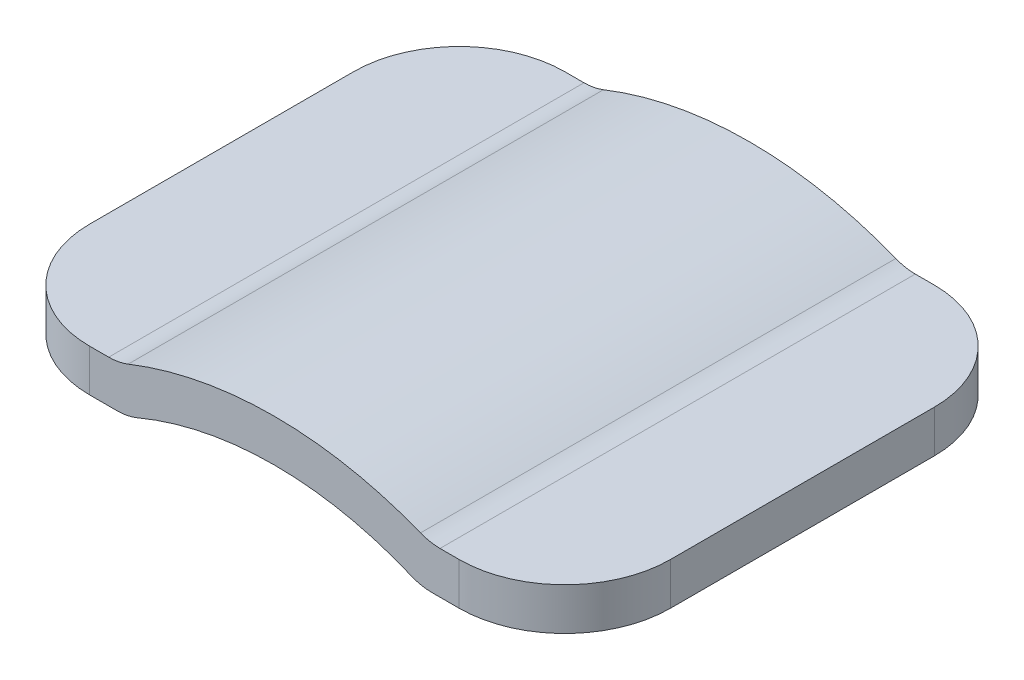
from build123d import *

# Parameters (mm, degrees)
EXTRUDE_1_DEPTH     = 900
SKETCH_3_OUTSIDE_W  = 2773.258
SKETCH_3_OUTSIDE_H  = 2373.258
CUT_EXTRUDE_3_DEPTH = 1431.244734302


with BuildPart() as part:
    # Эскиз1 → Бобышка-Вытянуть1 (new, symmetric)
    with BuildSketch(Plane.XY):
        with BuildLine():
            Line((-1100, -120), (-1100, 40))
            Line((-1100, 40), (-627.375485654, 40))
            ThreePointArc((-627.375485654, 40), (-589.802028189, 43.561115626), (-553.566604989, 54.117647059))
            ThreePointArc((-553.566604989, 54.117647059), (0, 160), (553.566604989, 54.117647059))
            ThreePointArc((553.566604989, 54.117647059), (589.802028189, 43.561115626), (627.375485654, 40))
            Line((627.375485654, 40), (1100, 40))
            Line((1100, 40), (1100, -120))
            Line((1100, -120), (595.98657703, -120))
            ThreePointArc((595.98657703, -120), (556.509475332, -116.065189265), (518.58572287, -104.415584416))
            ThreePointArc((518.58572287, -104.415584416), (0, 0), (-518.58572287, -104.415584416))
            ThreePointArc((-518.58572287, -104.415584416), (-556.509475332, -116.065189265), (-595.98657703, -120))
            Line((-595.98657703, -120), (-1100, -120))
        make_face()
    extrude(amount=EXTRUDE_1_DEPTH, both=True)

    # Эскиз3 outside → Вырез-Вытянуть3 (cut, through all)
    with BuildSketch(Plane(origin=(0, 40, 0), x_dir=(1, 0, 0), z_dir=(0, 1, 0))):
        Rectangle(SKETCH_3_OUTSIDE_W, SKETCH_3_OUTSIDE_H)
        with BuildLine():
            Line((700, 900), (-700, 900))
            ThreePointArc((-700, 900), (-982.842712475, 782.842712475), (-1100, 500))
            Line((-1100, 500), (-1100, -500))
            ThreePointArc((-1100, -500), (-982.842712475, -782.842712475), (-700, -900))
            Line((-700, -900), (700, -900))
            ThreePointArc((700, -900), (982.842712475, -782.842712475), (1100, -500))
            Line((1100, -500), (1100, 500))
            ThreePointArc((1100, 500), (982.842712475, 782.842712475), (700, 900))
        make_face(mode=Mode.SUBTRACT)
    extrude(amount=-CUT_EXTRUDE_3_DEPTH, mode=Mode.SUBTRACT)


solid = part.part
